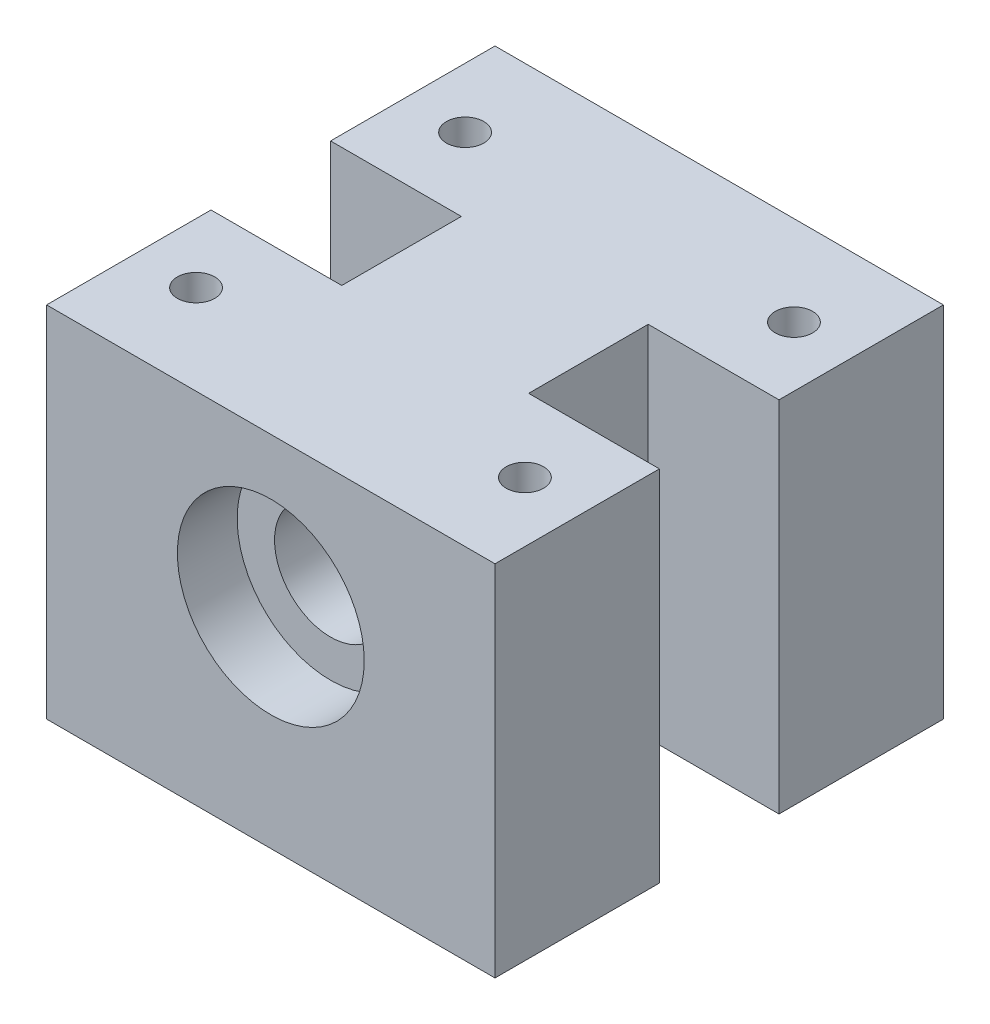
from build123d import *

# Parameters (mm, degrees)
SKETCH1_W           = 38.1
SKETCH1_H           = 35.56
BOSS_EXTRUDE2_DEPTH = 19.05
SKETCH2_R           = 7.9375
CUT_EXTRUDE1_DEPTH  = 5.08
SKETCH3_R           = 4.7625
CUT_EXTRUDE2_DEPTH  = 43.063657711
SKETCH4_R           = 1.5875
CUT_EXTRUDE3_DEPTH  = 45.612986898
SKETCH5_W           = 11.1125
SKETCH5_H           = 10.16
CUT_EXTRUDE4_DEPTH  = 45.612986898
CUT_EXTRUDE5_DEPTH  = 5.08


with BuildPart() as part:
    # Sketch1 → Boss-Extrude2 (new, symmetric)
    with BuildSketch(Plane.XY):
        Rectangle(SKETCH1_W, SKETCH1_H)
    extrude(amount=BOSS_EXTRUDE2_DEPTH, both=True)

    # Sketch2 → Cut-Extrude1 (cut)
    with BuildSketch(Plane.XY.offset(19.05)):
        Circle(SKETCH2_R)
    cut_extrude1 = extrude(amount=-CUT_EXTRUDE1_DEPTH, mode=Mode.SUBTRACT)

    # Sketch3 → Cut-Extrude2 (cut, through all)
    with BuildSketch(Plane.XY.offset(13.97)):
        Circle(SKETCH3_R)
    extrude(amount=-CUT_EXTRUDE2_DEPTH, mode=Mode.SUBTRACT)

    # Mirror1: Cut-Extrude1 across plane
    add(cut_extrude1.mirror(Plane.XY), mode=Mode.SUBTRACT)

    # Sketch4 → Cut-Extrude3 (cut, through all)
    with BuildSketch(Plane.XZ.offset(17.78)):
        with Locations(Location((13.97, 11.43, 0), (0, 0, 270))):
            Circle(SKETCH4_R)
        with Locations(Location((13.97, -11.43, 0), (0, 0, 270))):
            Circle(SKETCH4_R)
        with Locations(Location((-13.97, -11.43, 0), (0, 0, 270))):
            Circle(SKETCH4_R)
        with Locations(Location((-13.97, 11.43, 0), (0, 0, 270))):
            Circle(SKETCH4_R)
    extrude(amount=-CUT_EXTRUDE3_DEPTH, mode=Mode.SUBTRACT)

    # Sketch5 → Cut-Extrude4 (cut, through all)
    with BuildSketch(Plane(origin=(0, 17.78, 0), x_dir=(1, 0, 0), z_dir=(0, 1, 0))):
        with Locations((13.49375, 0)):
            Rectangle(SKETCH5_W, SKETCH5_H)
    cut_extrude4 = extrude(amount=-CUT_EXTRUDE4_DEPTH, mode=Mode.SUBTRACT)

    # Mirror2: Cut-Extrude4 across plane
    add(cut_extrude4.mirror(Plane(origin=(0, 0, 0), x_dir=(0, 0, 1), z_dir=(1, 0, 0))), mode=Mode.SUBTRACT)

    # Sketch6 → Cut-Extrude5 (cut)
    with BuildSketch(Plane(origin=(0, 17.78, 0), x_dir=(1, 0, 0), z_dir=(0, 1, 0))):
        Polygon((-19.05, 5.08), (-7.9375, 5.08), (-7.9375, -5.08), (-19.05, -5.08), (-19.05, -19.05), (19.05, -19.05), (19.05, -5.08), (7.9375, -5.08), (7.9375, 5.08), (19.05, 5.08), (19.05, 19.05), (-19.05, 19.05), align=None)
    extrude(amount=-CUT_EXTRUDE5_DEPTH, mode=Mode.SUBTRACT)


solid = part.part
